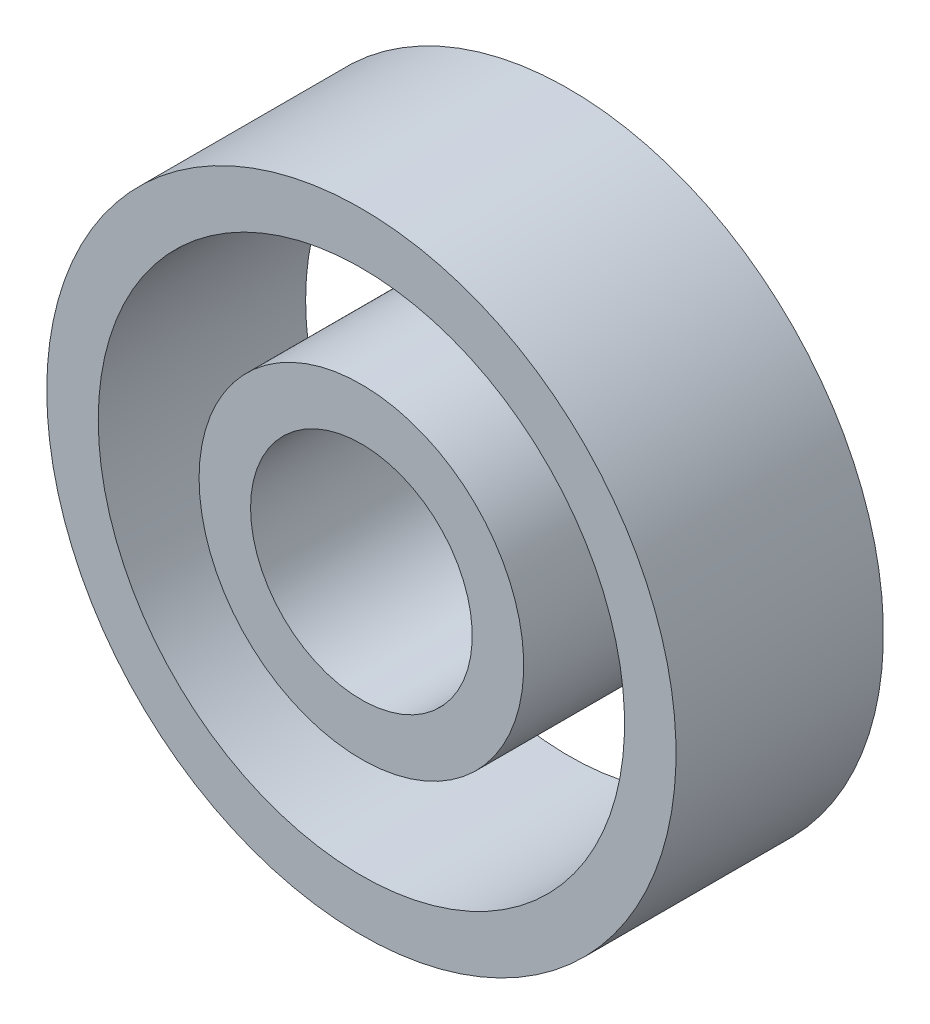
from build123d import *

# Parameters (mm, degrees)
SKETCH_1_R        = 11
SKETCH_1_R_2      = 9.2
EXTRUDE_1_DEPTH   = 7.25
SKETCH_1_R_3      = 5.675
SKETCH_1_R_4      = 3.875
EXTRUDE_1_2_DEPTH = 7.25


with BuildPart() as part:
    # 스케치1 → 보스-돌출1 (new body)
    with BuildSketch(Plane.XY):
        with Locations(Location((0, 0, 0), (0, 0, 180))):
            Circle(SKETCH_1_R)
        with Locations(Location((0, 0, 0), (0, 0, 180))):
            Circle(SKETCH_1_R_2, mode=Mode.SUBTRACT)
    extrude(amount=EXTRUDE_1_DEPTH)


with BuildPart() as body_2:
    # 스케치1 → Extrude 1 2 (new body)
    with BuildSketch(Plane.XY):
        with Locations(Location((0, 0, 0), (0, 0, 180))):
            Circle(SKETCH_1_R_3)
        with Locations(Location((0, 0, 0), (0, 0, 180))):
            Circle(SKETCH_1_R_4, mode=Mode.SUBTRACT)
    extrude(amount=EXTRUDE_1_2_DEPTH)


solid = Compound([part.part, body_2.part])
